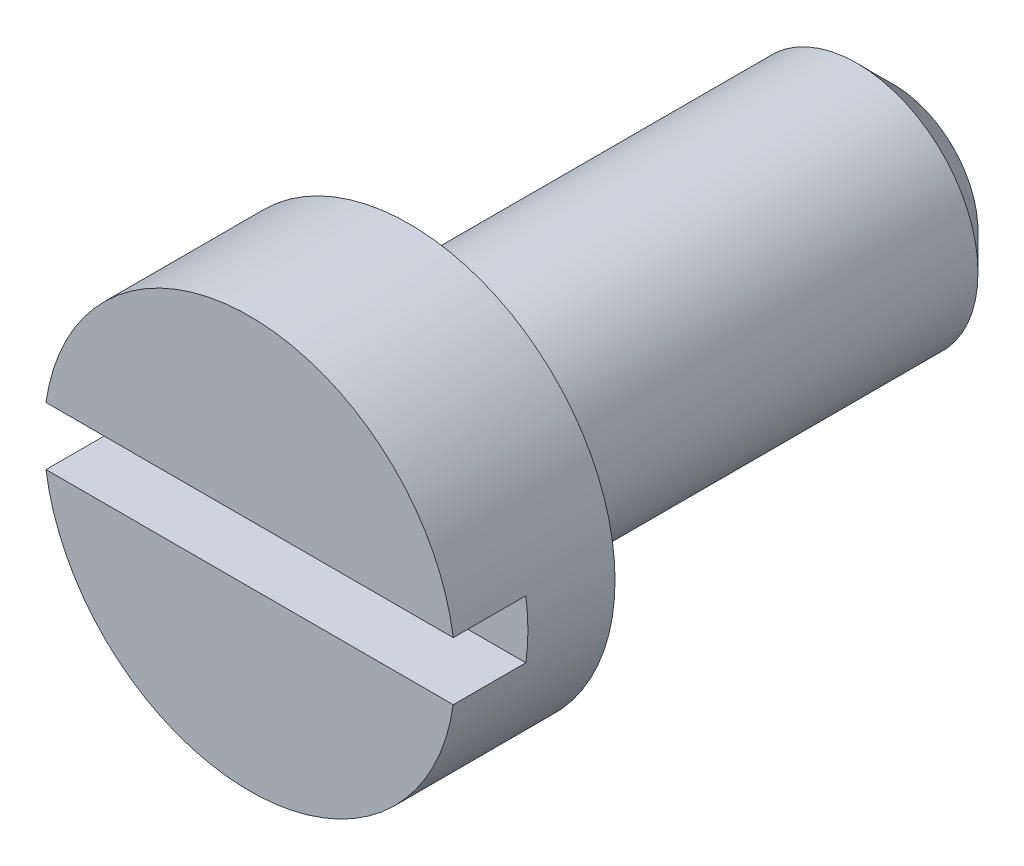
from build123d import *

# Parameters (mm, degrees)
SKETCH_12_R         = 4.25
EXTRUDE_3_DEPTH     = 3.3
SKETCH_13_R         = 2.5
EXTRUDE_4_DEPTH     = 10
SKETCH_20_W         = 9.006613757
SKETCH_20_H         = 1.2
CUT_EXTRUDE_8_DEPTH = 1.5
CHAMFER_1_SIZE      = 0.75


with BuildPart() as part:
    # Эскиз12 → Вытянуть3 (new body)
    with BuildSketch(Plane.XY):
        Circle(SKETCH_12_R)
    extrude(amount=EXTRUDE_3_DEPTH)

    # Эскиз13 → Вытянуть4 (add)
    with BuildSketch(Plane(origin=(0, 0, 0), x_dir=(-1, 0, 0), z_dir=(0, 0, -1))):
        with Locations(Location((0, 0, 0), (0, 0, 180))):
            Circle(SKETCH_13_R)
    extrude(amount=EXTRUDE_4_DEPTH)

    # Эскиз20 → Вырез-Вытянуть8 (cut)
    with BuildSketch(Plane.XY.offset(3.3)):
        with Locations((-0.065476191, 0)):
            Rectangle(SKETCH_20_W, SKETCH_20_H)
    extrude(amount=-CUT_EXTRUDE_8_DEPTH, mode=Mode.SUBTRACT)

    # Фаска1
    chamfer_1_edges = [part.edges().sort_by_distance(p)[0] for p in [
        (-2.5, 0, -10),
    ]]
    chamfer(chamfer_1_edges, length=CHAMFER_1_SIZE)


solid = part.part
